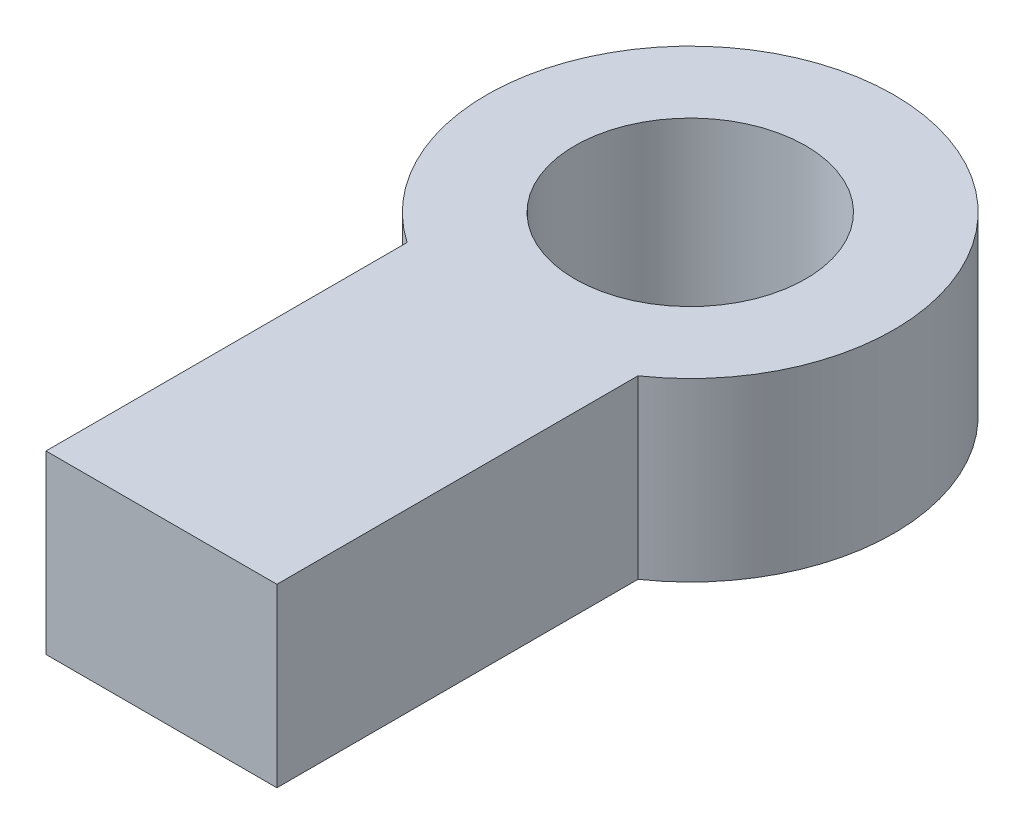
from build123d import *

# Parameters (mm, degrees)
SKETCH1_R           = 5.8674
SKETCH1_R_2         = 3.3274
BOSS_EXTRUDE1_DEPTH = 5.08
BOSS_EXTRUDE2_DEPTH = 5.08


with BuildPart() as part:
    # Sketch1 → Boss-Extrude1 (new body)
    with BuildSketch(Plane(origin=(0, 0, 0), x_dir=(-1, 0, 0), z_dir=(0, 1, 0))):
        with Locations(Location((0, 0, 0), (0, 0, 90))):
            Circle(SKETCH1_R)
        with Locations(Location((0, 0, 0), (0, 0, 90))):
            Circle(SKETCH1_R_2, mode=Mode.SUBTRACT)
    extrude(amount=BOSS_EXTRUDE1_DEPTH)

    # Sketch2 → Boss-Extrude2 (add)
    with BuildSketch(Plane.XZ):
        with BuildLine():
            Line((-3.3274, 0), (-3.3274, 15.24))
            Line((-3.3274, 15.24), (3.3274, 15.24))
            Line((3.3274, 15.24), (3.3274, 0))
            ThreePointArc((3.3274, 0), (0, 3.3274), (-3.3274, 0))
        make_face()
    extrude(amount=-BOSS_EXTRUDE2_DEPTH)


solid = part.part
